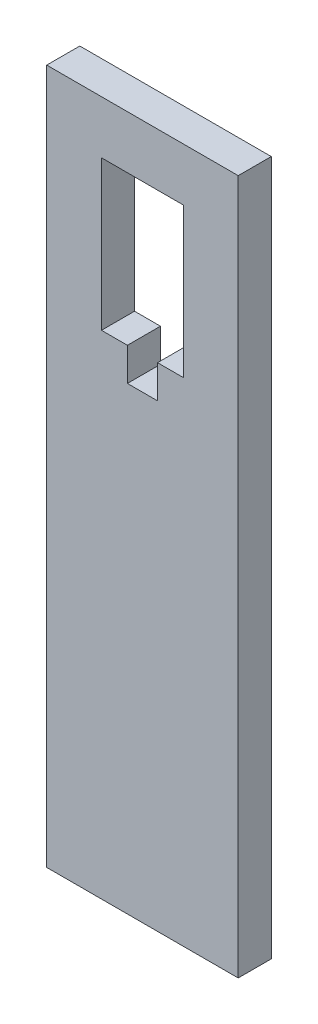
from build123d import *

# Parameters (mm, degrees)
SKETCH1_W           = 28.96
SKETCH1_H           = 74.5
BOSS_EXTRUDE1_DEPTH = 5
SKETCH2_W           = 8.28
SKETCH2_H           = 5
BOSS_EXTRUDE2_DEPTH = 22.6
SKETCH3_W           = 28.96
SKETCH3_H           = 5
BOSS_EXTRUDE3_DEPTH = 8
SKETCH4_W           = 4.56
SKETCH4_H           = 5
CUT_EXTRUDE1_DEPTH  = 5


with BuildPart() as part:
    # Sketch1 → Boss-Extrude1 (new body)
    with BuildSketch(Plane.XY):
        with Locations((-4.078230088, -6.160265487)):
            Rectangle(SKETCH1_W, SKETCH1_H)
    extrude(amount=BOSS_EXTRUDE1_DEPTH)

    # Sketch2 → Boss-Extrude2 (add)
    with BuildSketch(Plane(origin=(0, 31.089734513, 0), x_dir=(1, 0, 0), z_dir=(0, 1, 0))):
        with Locations((-14.418230088, -2.5)):
            Rectangle(SKETCH2_W, SKETCH2_H)
        with Locations((6.261769912, -2.5)):
            Rectangle(SKETCH2_W, SKETCH2_H)
    extrude(amount=BOSS_EXTRUDE2_DEPTH)

    # Sketch3 → Boss-Extrude3 (add)
    with BuildSketch(Plane(origin=(0, 53.689734513, 0), x_dir=(1, 0, 0), z_dir=(0, 1, 0))):
        with Locations((-4.078230088, -2.5)):
            Rectangle(SKETCH3_W, SKETCH3_H)
    extrude(amount=BOSS_EXTRUDE3_DEPTH)

    # Sketch4 → Cut-Extrude1 (cut)
    with BuildSketch(Plane(origin=(0, 31.089734513, 0), x_dir=(1, 0, 0), z_dir=(0, 1, 0))):
        with Locations((-4.078230088, -2.5)):
            Rectangle(SKETCH4_W, SKETCH4_H)
    extrude(amount=-CUT_EXTRUDE1_DEPTH, mode=Mode.SUBTRACT)


solid = part.part
